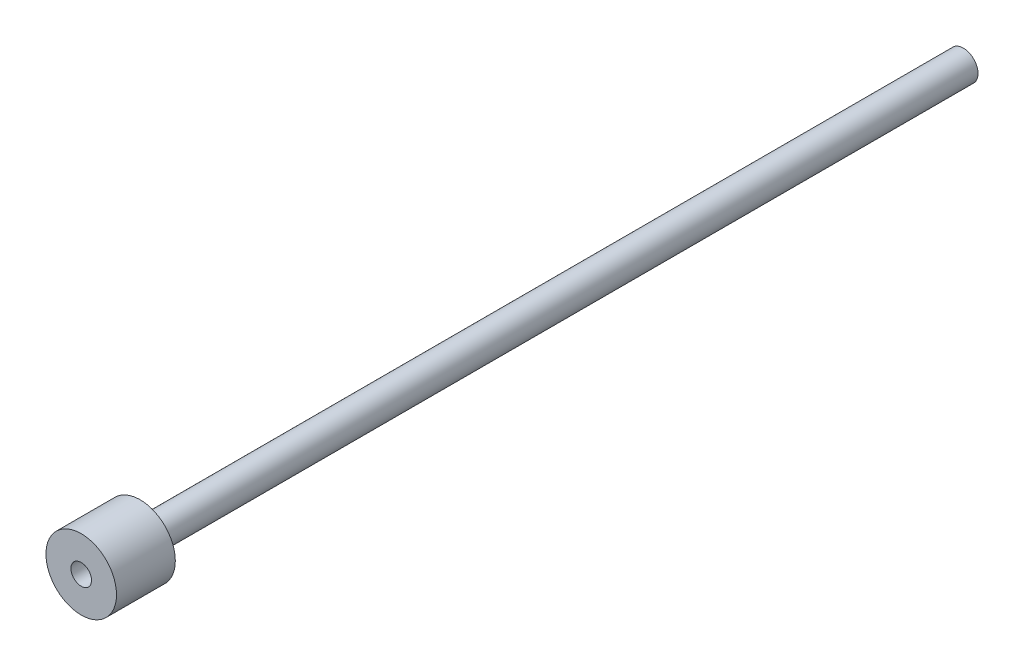
from build123d import *

# Parameters (mm, degrees)
SKETCH1_R           = 12
BOSS_EXTRUDE1_DEPTH = 20
SKETCH2_R           = 8.75
SKETCH2_R_2         = 5
CUT_EXTRUDE1_DEPTH  = 15
SKETCH3_R           = 3.5
CUT_EXTRUDE2_DEPTH  = 27.229754097
SKETCH4_R           = 5
SKETCH4_R_2         = 3.5
BOSS_EXTRUDE2_DEPTH = 280


with BuildPart() as part:
    # Sketch1 → Boss-Extrude1 (new body)
    with BuildSketch(Plane.XY):
        Circle(SKETCH1_R)
    extrude(amount=BOSS_EXTRUDE1_DEPTH)

    # Sketch2 → Cut-Extrude1 (cut)
    with BuildSketch(Plane(origin=(0, 0, 0), x_dir=(-1, 0, 0), z_dir=(0, 0, -1))):
        Circle(SKETCH2_R)
        Circle(SKETCH2_R_2, mode=Mode.SUBTRACT)
    extrude(amount=-CUT_EXTRUDE1_DEPTH, mode=Mode.SUBTRACT)

    # Sketch3 → Cut-Extrude2 (cut, through all)
    with BuildSketch(Plane.XY.offset(20)):
        Circle(SKETCH3_R)
    extrude(amount=-CUT_EXTRUDE2_DEPTH, mode=Mode.SUBTRACT)

    # Sketch4 → Boss-Extrude2 (add)
    with BuildSketch(Plane(origin=(0, 0, 0), x_dir=(-1, 0, 0), z_dir=(0, 0, -1))):
        Circle(SKETCH4_R)
        with Locations(Location((0, 0, 0), (0, 0, 180))):
            Circle(SKETCH4_R_2, mode=Mode.SUBTRACT)
    extrude(amount=BOSS_EXTRUDE2_DEPTH)


solid = part.part
